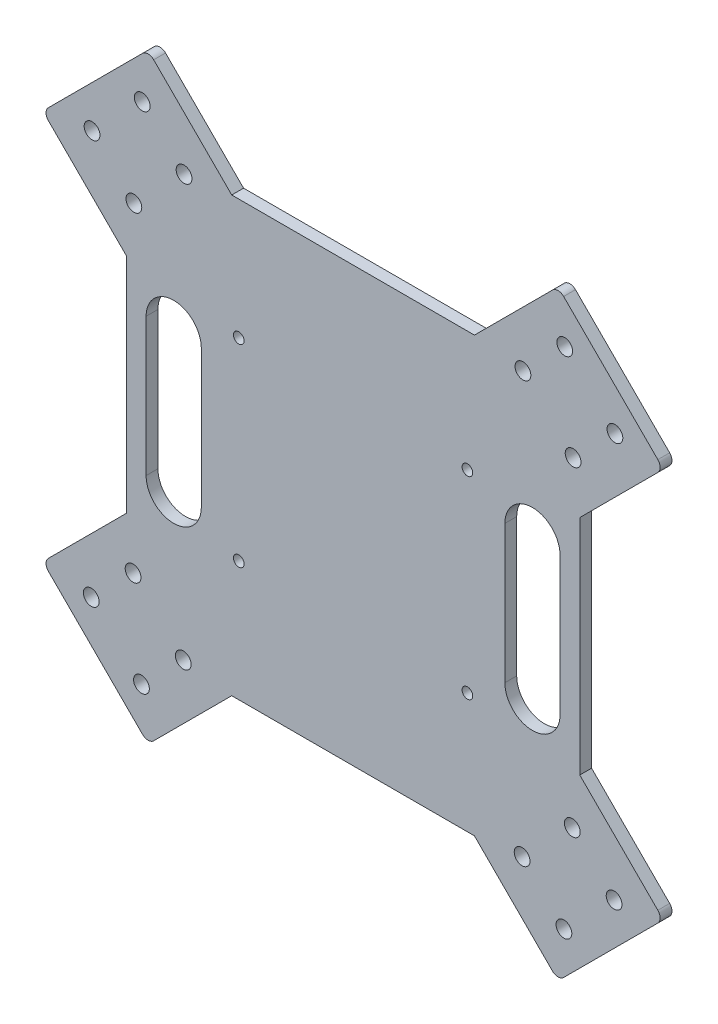
from build123d import *

# Parameters (mm, degrees)
SKETCH1_R           = 1.35
BOSS_EXTRUDE1_DEPTH = 3
SKETCH2_R           = 2
CUT_EXTRUDE1_DEPTH  = 110.604839186
FILLET1_R           = 2


with BuildPart() as part:
    # Sketch1 → Boss-Extrude1 (new body)
    with BuildSketch(Plane.XY):
        Polygon((78.713203436, 49.493203436), (57.5, 28.28), (57.5, -28.28), (78.713203436, -49.493203436), (51.993203436, -76.213203436), (30.78, -55), (-30.78, -55), (-51.993203436, -76.213203436), (-78.713203436, -49.493203436), (-57.5, -28.28), (-57.5, 28.28), (-78.713203436, 49.493203436), (-51.993203436, 76.213203436), (-30.78, 55), (30.78, 55), (51.993203436, 76.213203436), align=None)
        with Locations((29, -24.5)):
            Circle(SKETCH1_R, mode=Mode.SUBTRACT)
        with Locations((29, 24.5)):
            Circle(SKETCH1_R, mode=Mode.SUBTRACT)
        with Locations((-29, -24.5)):
            Circle(SKETCH1_R, mode=Mode.SUBTRACT)
        with Locations((-29, 24.5)):
            Circle(SKETCH1_R, mode=Mode.SUBTRACT)
    extrude(amount=BOSS_EXTRUDE1_DEPTH)

    # Sketch2 → Cut-Extrude1 (cut, through all)
    with BuildSketch(Plane.XY.offset(3)):
        with Locations((43.079339828, 53.30726189)):
            Circle(SKETCH2_R)
        with Locations((53.685941546, 63.913863607)):
            Circle(SKETCH2_R)
        with Locations((55.80726189, 40.579339828)):
            Circle(SKETCH2_R)
        with Locations((66.413863607, 51.185941546)):
            Circle(SKETCH2_R)
        with Locations((-66.413863607, -51.185941546)):
            Circle(SKETCH2_R)
        with Locations((-55.80726189, -40.579339828)):
            Circle(SKETCH2_R)
        with Locations((-43.079339828, -53.30726189)):
            Circle(SKETCH2_R)
        with Locations((-53.685941546, -63.913863607)):
            Circle(SKETCH2_R)
        with Locations((-53.479114875, 64.120690278)):
            Circle(SKETCH2_R)
        with Locations((-42.872513158, 53.51408856)):
            Circle(SKETCH2_R)
        with Locations((-55.600435219, 40.786166499)):
            Circle(SKETCH2_R)
        with Locations((-66.207036937, 51.392768217)):
            Circle(SKETCH2_R)
        with Locations((55.600435219, -40.786166499)):
            Circle(SKETCH2_R)
        with Locations((42.872513157, -53.51408856)):
            Circle(SKETCH2_R)
        with Locations((66.207036937, -51.392768217)):
            Circle(SKETCH2_R)
        with Locations((53.479114875, -64.120690278)):
            Circle(SKETCH2_R)
        with BuildLine():
            Line((-38.5, 17.5), (-38.5, -17.5))
            ThreePointArc((-38.5, -17.5), (-45.5, -24.5), (-52.5, -17.5))
            Line((-52.5, -17.5), (-52.5, 17.5))
            ThreePointArc((-52.5, 17.5), (-45.5, 24.5), (-38.5, 17.5))
        make_face()
        with BuildLine():
            Line((38.5, 17.5), (38.5, -17.5))
            ThreePointArc((38.5, -17.5), (45.5, -24.5), (52.5, -17.5))
            Line((52.5, -17.5), (52.5, 17.5))
            ThreePointArc((52.5, 17.5), (45.5, 24.5), (38.5, 17.5))
        make_face()
    extrude(amount=-CUT_EXTRUDE1_DEPTH, mode=Mode.SUBTRACT)

    # Fillet1
    fillet1_edges = [part.edges().sort_by_distance(p)[0] for p in [
        (78.713203436, -49.493203436, 1.5),
        (51.993203436, -76.213203436, 1.5),
        (-51.993203436, -76.213203436, 1.5),
        (-78.713203436, -49.493203436, 1.5),
        (-78.713203436, 49.493203436, 1.5),
        (-51.993203436, 76.213203436, 1.5),
        (51.993203436, 76.213203436, 1.5),
        (78.713203436, 49.493203436, 1.5),
    ]]
    fillet(fillet1_edges, radius=FILLET1_R)


solid = part.part
